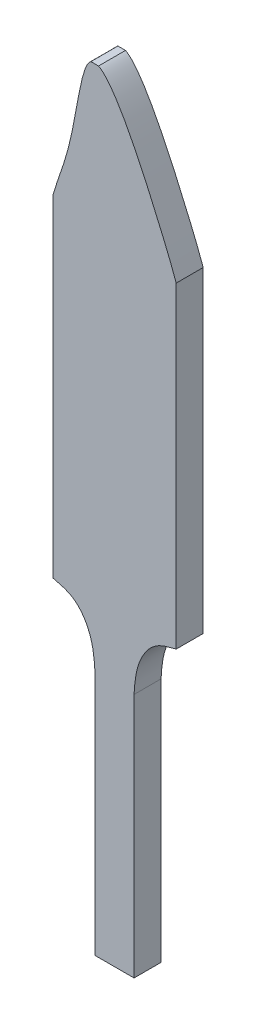
from build123d import *

# Parameters (mm, degrees)
BOSS_EXTRUDE1_DEPTH      = 8.49
BOSS_EXTRUDE1_DEPTH_BACK = 2


with BuildPart() as part:
    # Sketch5 → Boss-Extrude1 (new, two sides: drawn at the far end of the back side and taken through both)
    with BuildSketch(Plane.XY.offset(-BOSS_EXTRUDE1_DEPTH_BACK)):
        with BuildLine():
            add(Edge.make_bspline(
                [(-6.214416506, 150), (-0.083680578, 146.836659722), (12.227049193, 121.171627413), (22.115504043, 97.266361341), (23.975, 92.038961998)],
                knots=[0.59541155, 0.59541155, 0.59541155, 0.59541155, 0.789536521, 0.848897281, 0.848897281, 0.848897281, 0.848897281], degree=3))
            Line((-6.214416506, 150), (-9.181360733, 150))
            add(Edge.make_bspline(
                [(-23.975, 97.550523877), (-22.525140626, 102.797342224), (-14.830547849, 121.396895041), (-13.344437158, 147.084687463), (-9.181360733, 150)],
                knots=[0.316420869, 0.316420869, 0.316420869, 0.316420869, 0.391637385, 0.56041045, 0.56041045, 0.56041045, 0.56041045], degree=3))
            Line((-23.975, 97.550523877), (-23.975, -31.128230966))
            add(Edge.make_bspline(
                [(-23.975, -31.128230966), (-21.293057089, -31.780629914), (-13.925723024, -33.572778799), (-8.294753832, -44.012214815), (-7.791781952, -51.627914113), (-7.595916378, -54.593593445)],
                knots=[0, 0, 0, 0, 0.258985483, 0.711436685, 1, 1, 1, 1], degree=3))
            Line((-7.595916378, -54.593593445), (-7.595916378, -150))
            Line((-7.595916378, -150), (7.595916378, -150))
            Line((7.595916378, -150), (7.595916378, -54.593593445))
            add(Edge.make_bspline(
                [(23.975, -31.128230966), (21.293057089, -31.780629914), (13.925723024, -33.572778799), (8.294753832, -44.012214815), (7.791781952, -51.627914113), (7.595916378, -54.593593445)],
                knots=[0, 0, 0, 0, 0.258985483, 0.711436685, 1, 1, 1, 1], degree=3))
            Line((23.975, -31.128230966), (23.975, 92.038961998))
        make_face()
    extrude(amount=BOSS_EXTRUDE1_DEPTH + BOSS_EXTRUDE1_DEPTH_BACK)


solid = part.part
